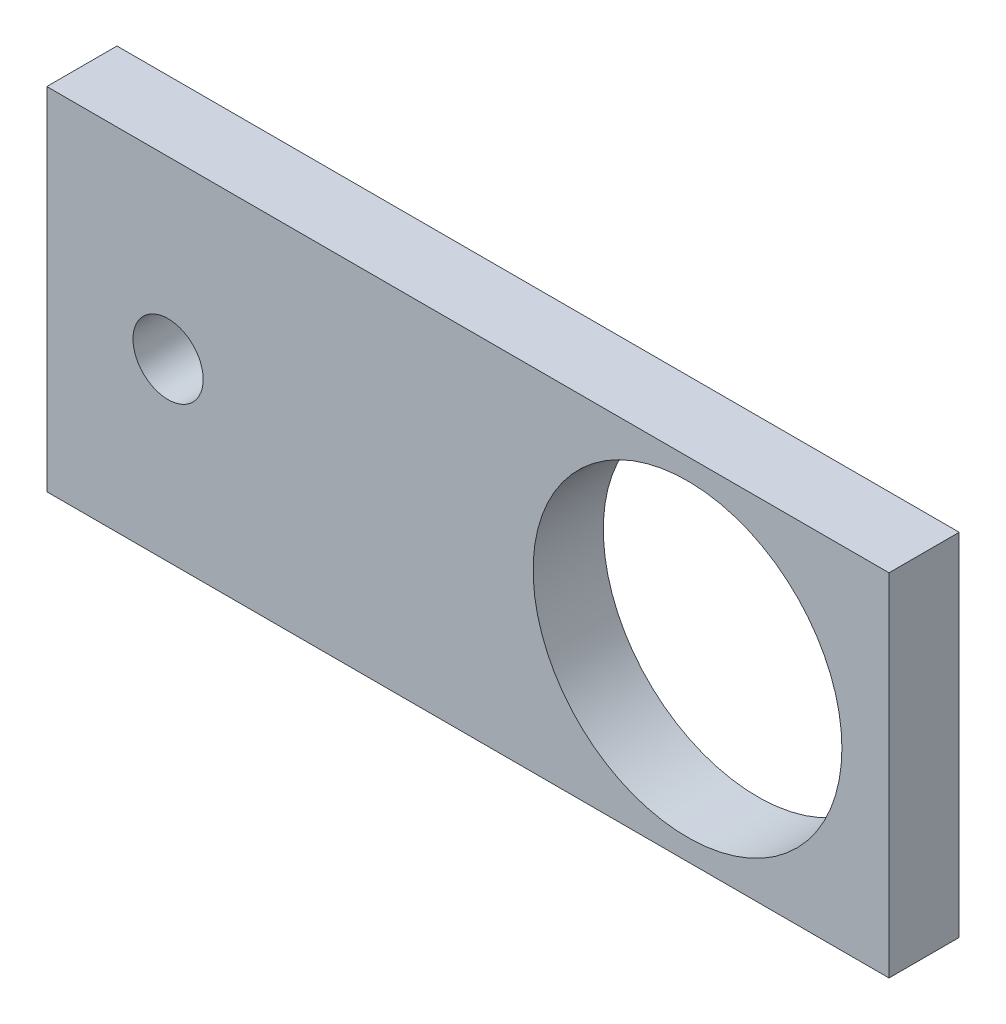
from build123d import *

# Parameters (mm, degrees)
SKETCH1_W           = 60
SKETCH1_H           = 25
SKETCH1_R           = 2.5
SKETCH1_R_2         = 11
BOSS_EXTRUDE2_DEPTH = 5


with BuildPart() as part:
    # Sketch1 → Boss-Extrude2 (new body)
    with BuildSketch(Plane.XY):
        Rectangle(SKETCH1_W, SKETCH1_H)
        with Locations((-21.359853693, 0)):
            Circle(SKETCH1_R, mode=Mode.SUBTRACT)
        with Locations((15.644174596, 0)):
            Circle(SKETCH1_R_2, mode=Mode.SUBTRACT)
    extrude(amount=BOSS_EXTRUDE2_DEPTH)


solid = part.part
